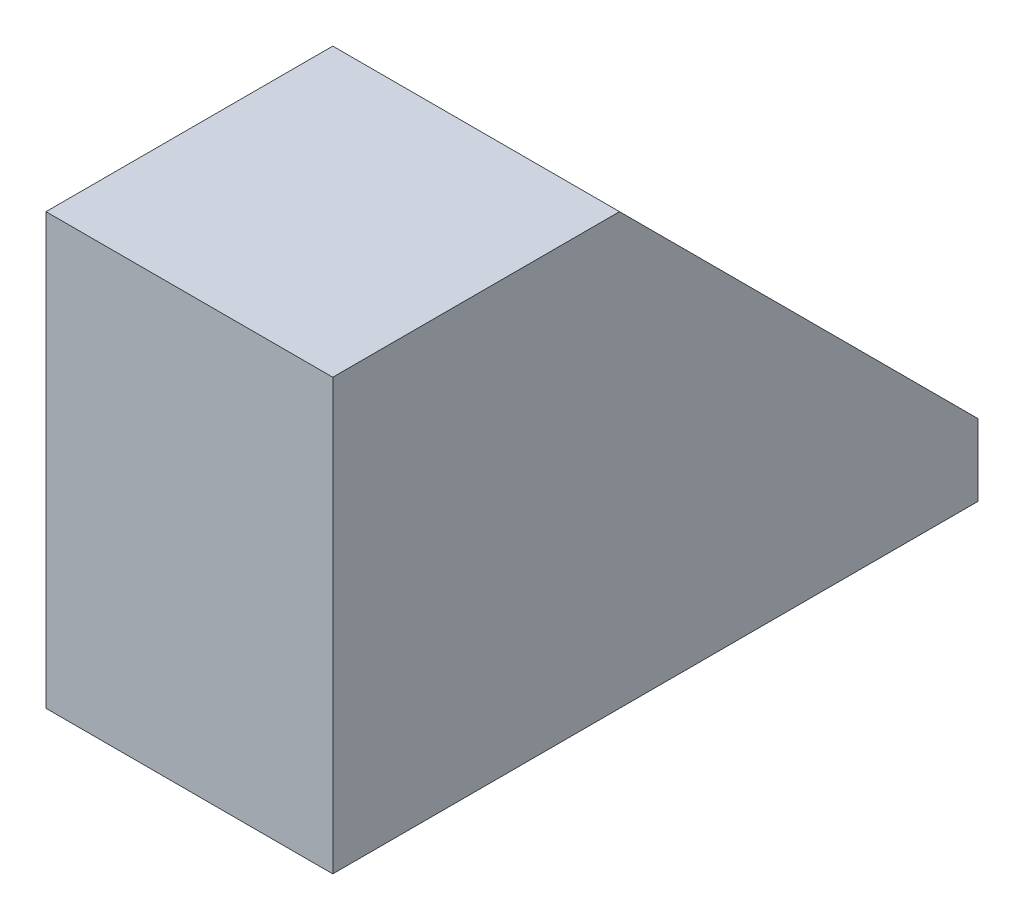
from build123d import *

# Parameters (mm, degrees)
SALIENTE_EXTRUIR3_DEPTH = 40


with BuildPart() as part:
    # Croquis4 → Saliente-Extruir3 (new body)
    with BuildSketch(Plane(origin=(0, 0, 0), x_dir=(0, 0, -1), z_dir=(1, 0, 0))):
        Polygon((-5, 30), (45, -20), (45, -30), (-45, -30), (-45, 30), align=None)
    extrude(amount=SALIENTE_EXTRUIR3_DEPTH)


solid = part.part
